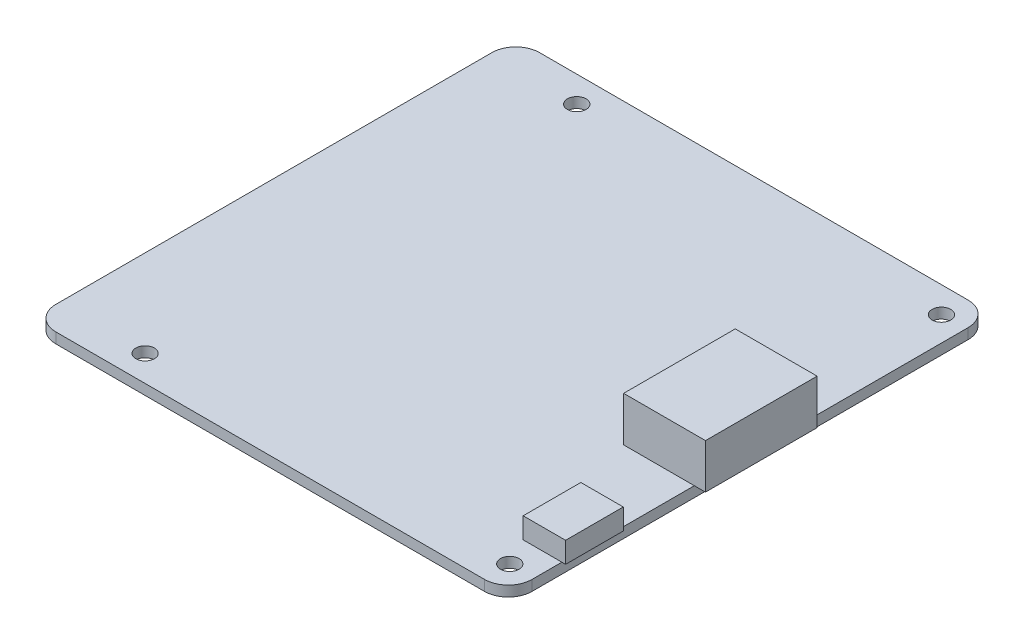
from build123d import *

# Parameters (mm, degrees)
SKETCH1_W           = 64
SKETCH1_H           = 65
SKETCH1_R           = 1.25
BOSS_EXTRUDE1_DEPTH = 1.4
SKETCH2_W           = 11
SKETCH2_H           = 15
BOSS_EXTRUDE2_DEPTH = 6
SKETCH3_W           = 5.7
SKETCH3_H           = 7.75
BOSS_EXTRUDE3_DEPTH = 2.8
FILLET1_R           = 3.2


with BuildPart() as part:
    # Sketch1 → Boss-Extrude1 (new body)
    with BuildSketch(Plane(origin=(0, 0, 0), x_dir=(1, 0, 0), z_dir=(0, 1, 0))):
        Rectangle(SKETCH1_W, SKETCH1_H)
        with Locations(Location((28.7, -29, 0), (0, 0, 270))):
            Circle(SKETCH1_R, mode=Mode.SUBTRACT)
        with Locations(Location((-20.3, -29, 0), (0, 0, 270))):
            Circle(SKETCH1_R, mode=Mode.SUBTRACT)
        with Locations(Location((-20.3, 29, 0), (0, 0, 270))):
            Circle(SKETCH1_R, mode=Mode.SUBTRACT)
        with Locations(Location((28.7, 29, 0), (0, 0, 270))):
            Circle(SKETCH1_R, mode=Mode.SUBTRACT)
    extrude(amount=BOSS_EXTRUDE1_DEPTH)

    # Sketch2 → Boss-Extrude2 (add)
    with BuildSketch(Plane(origin=(0, 1.4, 0), x_dir=(1, 0, 0), z_dir=(0, 1, 0))):
        with Locations((28, 0)):
            Rectangle(SKETCH2_W, SKETCH2_H)
    extrude(amount=BOSS_EXTRUDE2_DEPTH)

    # Sketch3 → Boss-Extrude3 (add)
    with BuildSketch(Plane(origin=(0, 1.4, 0), x_dir=(1, 0, 0), z_dir=(0, 1, 0))):
        with Locations((29.65, -21.425)):
            Rectangle(SKETCH3_W, SKETCH3_H)
    extrude(amount=BOSS_EXTRUDE3_DEPTH)

    # Fillet1
    fillet1_edges = [part.edges().sort_by_distance(p)[0] for p in [
        (32, 0.7, 32.5),
        (-32, 0.7, 32.5),
        (-32, 0.7, -32.5),
        (32, 0.7, -32.5),
    ]]
    fillet(fillet1_edges, radius=FILLET1_R)


solid = part.part
